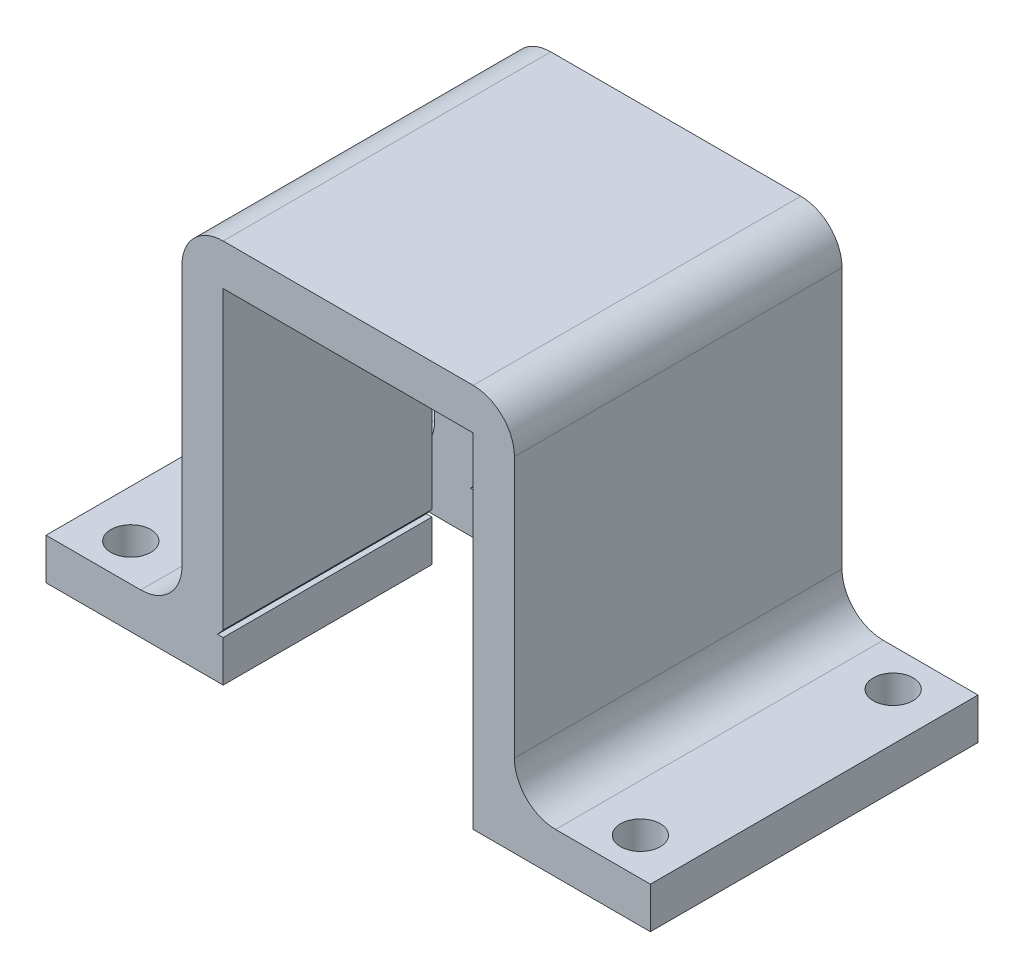
from build123d import *

# Parameters (mm, degrees)
BOSS_EXTRUDE1_DEPTH     = 23.85
SKETCH4_R               = 1.45
CUT_EXTRUDE3_DEPTH      = 10
CUT_EXTRUDE4_DEPTH      = 44.904811809
CUT_EXTRUDE4_DEPTH_BACK = 10
SKETCH9_W               = 3.2
SKETCH9_H               = 20


with BuildPart() as part:
    # Sketch1 → Boss-Extrude1 (new body)
    with BuildSketch(Plane.XY):
        with BuildLine():
            Line((-9.1, -10.52892562), (-9.1, 11))
            Line((-9.1, 11), (9.1, 11))
            Line((9.1, 11), (9.1, -11))
            Line((9.1, -11), (9.1, -14))
            Line((9.1, -14), (12.1, -14))
            Line((12.1, -14), (22, -14))
            Line((22, -14), (22, -11))
            Line((22, -11), (15.1, -11))
            ThreePointArc((15.1, -11), (12.978679656, -10.121320344), (12.1, -8))
            Line((12.1, -8), (12.1, 11))
            ThreePointArc((12.1, 11), (11.221320344, 13.121320344), (9.1, 14))
            Line((9.1, 14), (-9.1, 14))
            ThreePointArc((-9.1, 14), (-11.221320344, 13.121320344), (-12.1, 11))
            Line((-12.1, 11), (-12.1, -8))
            ThreePointArc((-12.1, -8), (-12.978679656, -10.121320344), (-15.1, -11))
            Line((-15.1, -11), (-22, -11))
            Line((-22, -11), (-22, -14))
            Line((-22, -14), (-12.1, -14))
            Line((-12.1, -14), (-9.1, -14))
            Line((-9.1, -14), (-9.1, -11))
            Line((-9.1, -11), (-9.507142857, -11))
            Line((-9.507142857, -11), (-9.1, -10.52892562))
        make_face()
    extrude(amount=BOSS_EXTRUDE1_DEPTH)

    # Sketch4 → Cut-Extrude3 (cut)
    with BuildSketch(Plane(origin=(0, -11, 0), x_dir=(1, 0, 0), z_dir=(0, 1, 0))):
        with Locations(Location((-18.55, -21.125, 0), (0, 0, 180))):
            Circle(SKETCH4_R)
        with Locations(Location((-18.55, -2.725, 0), (0, 0, 180))):
            Circle(SKETCH4_R)
        with Locations(Location((18.55, -21.125, 0), (0, 0, 270))):
            Circle(SKETCH4_R)
        with Locations(Location((18.55, -2.725, 0), (0, 0, 180))):
            Circle(SKETCH4_R)
    extrude(amount=-CUT_EXTRUDE3_DEPTH, mode=Mode.SUBTRACT)

    # Sketch9 → Cut-Extrude4 (cut, two sides: drawn at the far end of the back side and taken through both)
    with BuildSketch(Plane.ZY.offset(12.1).offset(-CUT_EXTRUDE4_DEPTH_BACK)):
        with Locations((7.05, -4)):
            Rectangle(SKETCH9_W, SKETCH9_H)
    extrude(amount=CUT_EXTRUDE4_DEPTH + CUT_EXTRUDE4_DEPTH_BACK, mode=Mode.SUBTRACT)


solid = part.part
